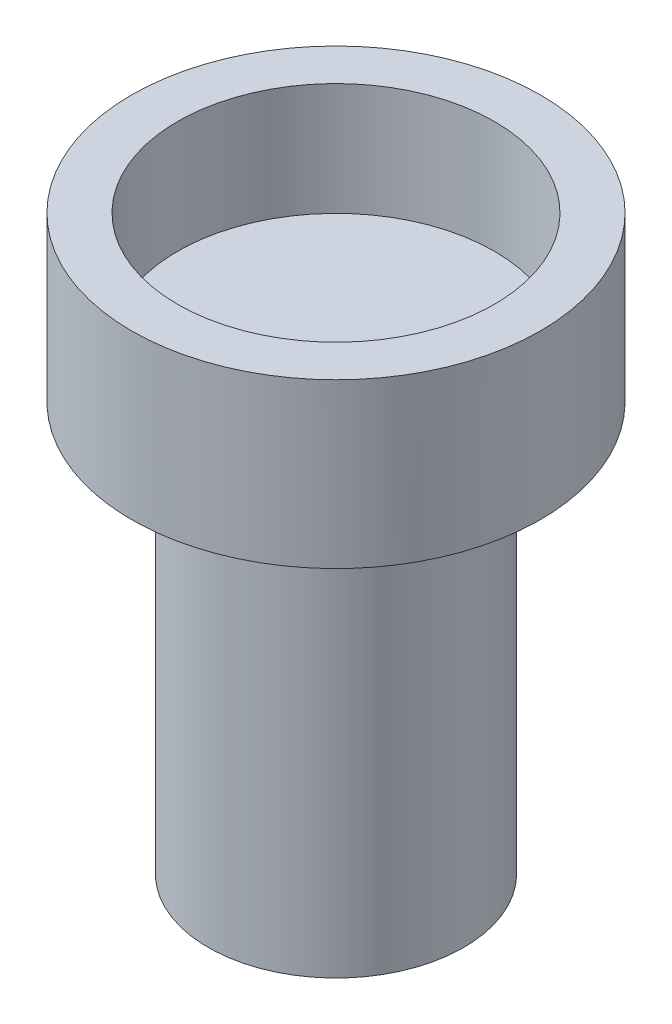
from build123d import *

# Parameters (mm, degrees)
ESQUISSE1_R        = 4
ESQUISSE1_R_2      = 3.1
BOSS_EXTRU_1_DEPTH = 2.2
BOSS_EXTRU_2_START = 1
ESQUISSE2_R        = 4
BOSS_EXTRU_2_DEPTH = 1
ESQUISSE3_R        = 2.5
BOSS_EXTRU_3_DEPTH = 8


with BuildPart() as part:
    # Esquisse1 → Boss.-Extru.1 (new body)
    with BuildSketch(Plane(origin=(0, 0, 0), x_dir=(1, 0, 0), z_dir=(0, 1, 0))):
        with Locations(Location((0, 0, 0), (0, 0, 270))):
            Circle(ESQUISSE1_R)
        with Locations(Location((0, 0, 0), (0, 0, 270))):
            Circle(ESQUISSE1_R_2, mode=Mode.SUBTRACT)
    extrude(amount=BOSS_EXTRU_1_DEPTH)

    # Esquisse2 → Boss.-Extru.2 (add)
    with BuildSketch(Plane.XZ.offset(BOSS_EXTRU_2_START)):
        with Locations(Location((0, 0, 0), (0, 0, 270))):
            Circle(ESQUISSE2_R)
    extrude(amount=-BOSS_EXTRU_2_DEPTH)

    # Esquisse3 → Boss.-Extru.3 (add)
    with BuildSketch(Plane.XZ.offset(1)):
        with Locations(Location((0, 0, 0), (0, 0, 270))):
            Circle(ESQUISSE3_R)
    extrude(amount=BOSS_EXTRU_3_DEPTH)


solid = part.part
